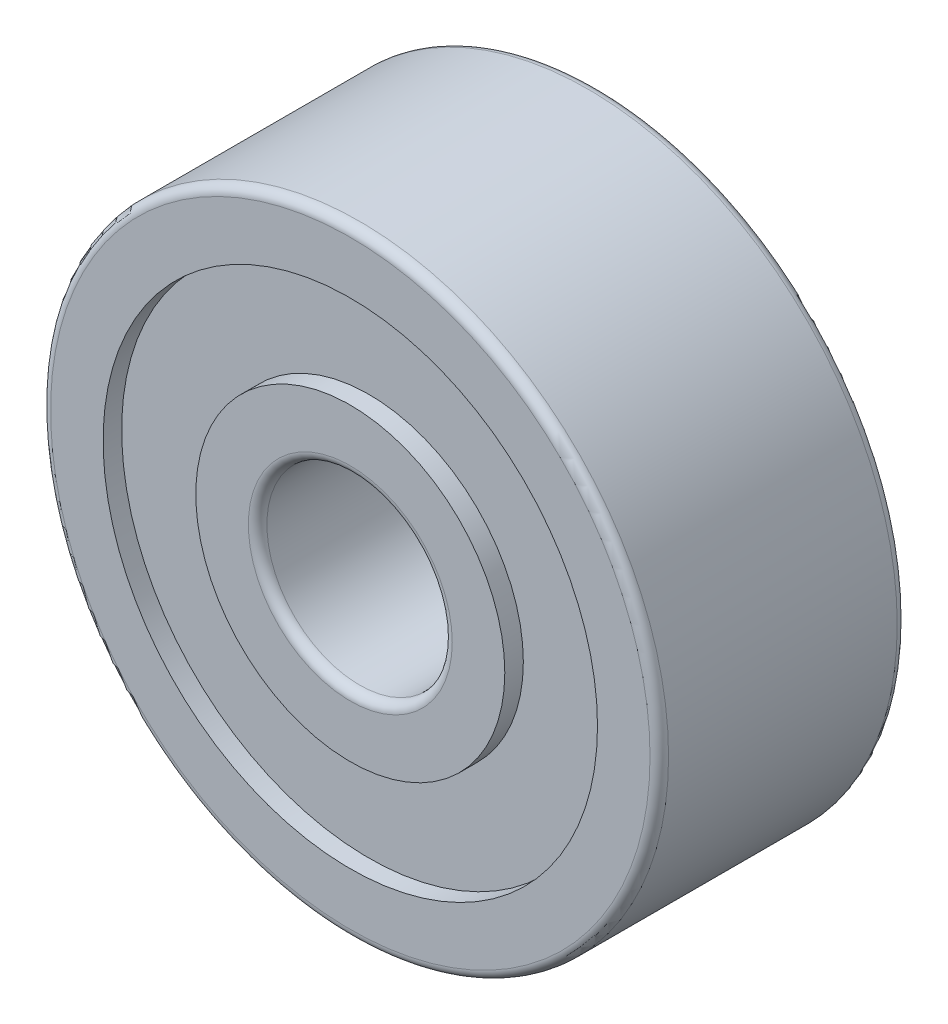
from build123d import *

# Parameters (mm, degrees)
SKETCH_1_R          = 5
SKETCH_1_R_2        = 1.5
EXTRUDE_1_DEPTH     = 4
SKETCH_2_R          = 4
SKETCH_2_R_2        = 2.5
CUT_EXTRUDE_1_DEPTH = 0.3
CUT_EXTRUDE_START   = -3.7
SKETCH_2_2_R        = 4
SKETCH_2_2_R_2      = 2.5
CUT_EXTRUDE_3_DEPTH = 0.3
FILLET_1_R          = 0.15


with BuildPart() as part:
    # Эскиз1 → Бобышка-Вытянуть1 (new body)
    with BuildSketch(Plane.XY):
        with Locations((-407.651902974, 139.372619686)):
            Circle(SKETCH_1_R)
        with Locations((-407.651902974, 139.372619686)):
            Circle(SKETCH_1_R_2, mode=Mode.SUBTRACT)
    extrude(amount=-EXTRUDE_1_DEPTH)

    # Эскиз2 → Вырез-Вытянуть1 (cut)
    with BuildSketch(Plane.XY):
        with Locations((-407.651902974, 139.372619686)):
            Circle(SKETCH_2_R)
        with Locations((-407.651902974, 139.372619686)):
            Circle(SKETCH_2_R_2, mode=Mode.SUBTRACT)
    extrude(amount=-CUT_EXTRUDE_1_DEPTH, mode=Mode.SUBTRACT)

    # Эскиз2<2> → Вырез-Вытянуть3 (cut)
    with BuildSketch(Plane.XY.offset(CUT_EXTRUDE_START)):
        with Locations((-407.651902974, 139.372619686)):
            Circle(SKETCH_2_2_R)
        with Locations((-407.651902974, 139.372619686)):
            Circle(SKETCH_2_2_R_2, mode=Mode.SUBTRACT)
    extrude(amount=-CUT_EXTRUDE_3_DEPTH, mode=Mode.SUBTRACT)

    # Скругление1
    fillet_1_edges = [part.edges().sort_by_distance(p)[0] for p in [
        (-412.651902974, 139.372619686, 0),
        (-412.651902974, 139.372619686, -4),
        (-409.151902974, 139.372619686, -4),
        (-409.151902974, 139.372619686, 0),
    ]]
    fillet(fillet_1_edges, radius=FILLET_1_R)


solid = part.part
